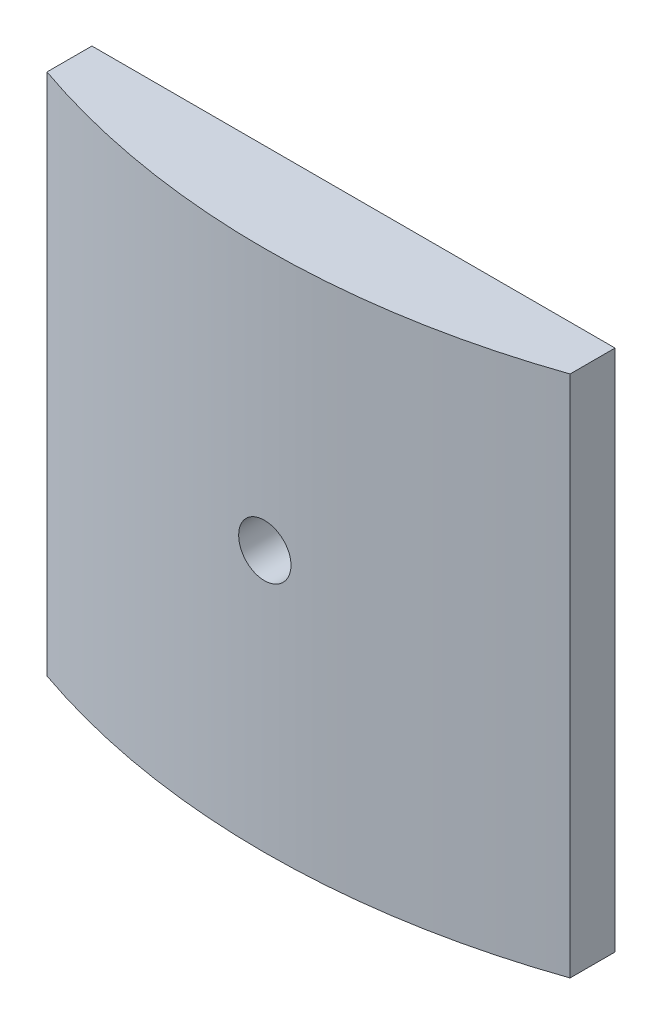
from build123d import *

# Parameters (mm, degrees)
BOSS_EXTRUDE1_DEPTH = 25
SKETCH3_R           = 1.25
CUT_EXTRUDE1_DEPTH  = 20


with BuildPart() as part:
    # Sketch2 → Boss-Extrude1 (new body)
    with BuildSketch(Plane(origin=(0, 0, 0), x_dir=(1, 0, 0), z_dir=(0, 1, 0))):
        with BuildLine():
            Line((0, -33.8431677), (-12.5, -33.8431677))
            Line((-12.5, -33.8431677), (-12.5, -35.991110013))
            ThreePointArc((-12.5, -35.991110013), (0, -38.1), (12.5, -35.991110013))
            Line((12.5, -35.991110013), (12.5, -33.8431677))
            Line((12.5, -33.8431677), (0, -33.8431677))
        make_face()
    extrude(amount=BOSS_EXTRUDE1_DEPTH)

    # Sketch3 → Cut-Extrude1 (cut)
    with BuildSketch(Plane(origin=(0, 0, 33.8431677), x_dir=(-1, 0, 0), z_dir=(0, 0, -1))):
        with Locations((0, 12.5)):
            Circle(SKETCH3_R)
    extrude(amount=-CUT_EXTRUDE1_DEPTH, mode=Mode.SUBTRACT)


solid = part.part
